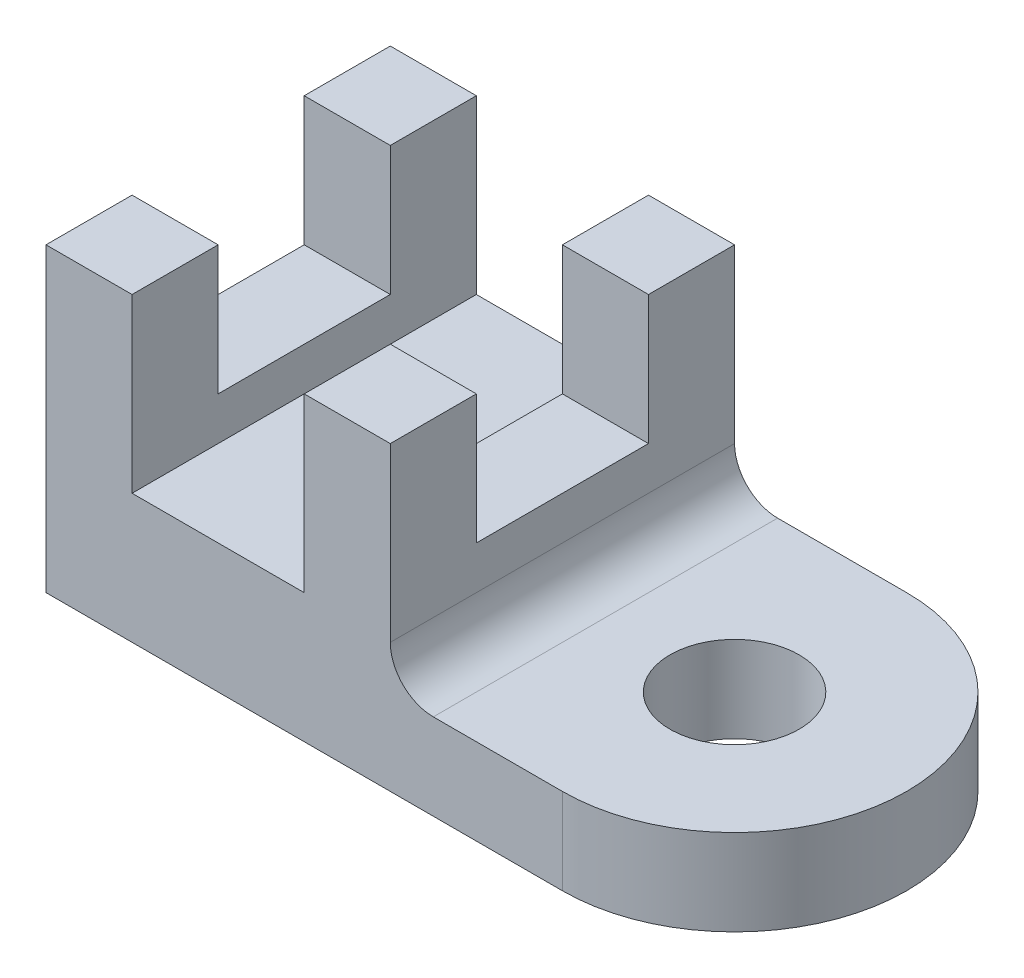
from build123d import *

# Parameters (mm, degrees)
BASE_DEPTH          = 25.4
SKETCH2_R           = 25.4
CIRCULAR_END_DEPTH  = 12.7
SKETCH3_R           = 9.525
HOLE_DEPTH          = 110.433918417
SKETCH4_W           = 25.4
SKETCH4_H           = 19.05
RECTANGLE_CUT_DEPTH = 73.122135992
FILLET1_R           = 6.35


with BuildPart() as part:
    # Sketch1 → base (new, symmetric)
    with BuildSketch(Plane.XY):
        Polygon((0, 0), (76.2, 0), (76.2, 12.7), (50.8, 12.7), (50.8, 44.45), (38.1, 44.45), (38.1, 19.05), (12.7, 19.05), (12.7, 44.45), (0, 44.45), align=None)
    extrude(amount=BASE_DEPTH, both=True)

    # Sketch2 → circular end (add)
    with BuildSketch(Plane.XZ):
        with Locations((76.2, 0)):
            Circle(SKETCH2_R)
    extrude(amount=-CIRCULAR_END_DEPTH)

    # Sketch3 → hole (cut, through all)
    with BuildSketch(Plane(origin=(0, 12.7, 0), x_dir=(1, 0, 0), z_dir=(0, 1, 0))):
        with Locations(Location((76.2, 0, 0), (0, 0, 180))):
            Circle(SKETCH3_R)
    extrude(amount=-HOLE_DEPTH, mode=Mode.SUBTRACT)

    # Sketch4 → rectangle cut (cut, through all)
    with BuildSketch(Plane(origin=(50.8, 0, 0), x_dir=(0, 0, -1), z_dir=(1, 0, 0))):
        with Locations((0, 34.925)):
            Rectangle(SKETCH4_W, SKETCH4_H)
    extrude(amount=-RECTANGLE_CUT_DEPTH, mode=Mode.SUBTRACT)

    # Fillet1
    fillet1_edges = [part.edges().sort_by_distance(p)[0] for p in [
        (50.8, 12.7, 0),
    ]]
    fillet(fillet1_edges, radius=FILLET1_R)


solid = part.part
